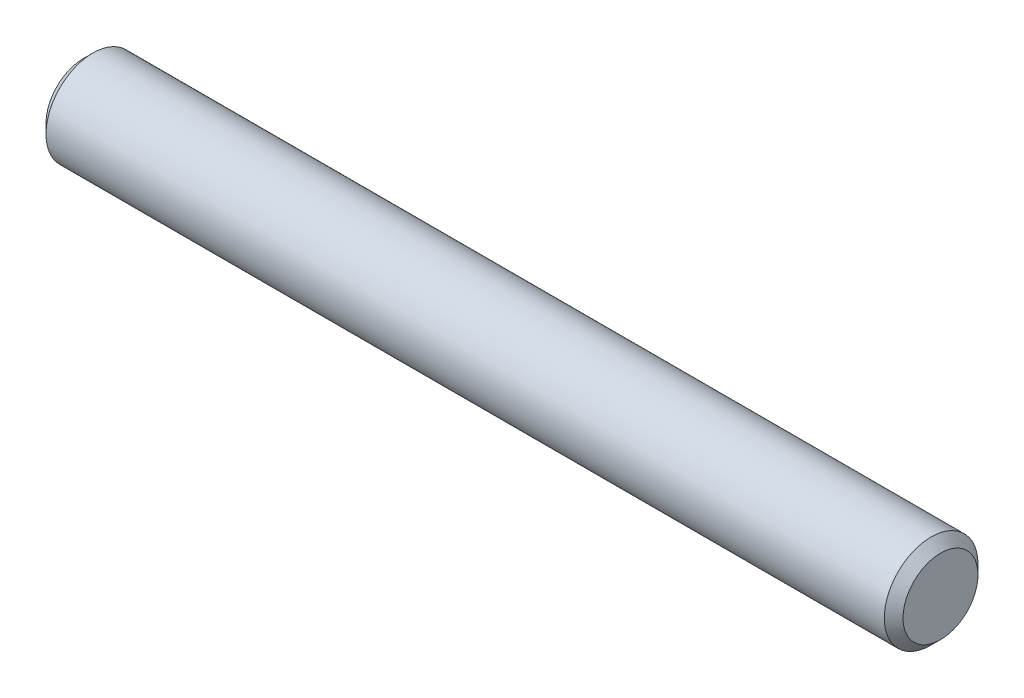
from build123d import *

# Parameters (mm, degrees)
EXTRUDE1_DEPTH      = 12.7
EXTRUDE1_DEPTH_BACK = 12.7
SKETCH2_R           = 1.3890625
CHAMFER1_SIZE       = 0.2778125


with BuildPart() as part:
    # Sketch2 → Extrude1 (new, two sides: drawn at the far end of the back side and taken through both)
    with BuildSketch(Plane(origin=(0, 0, 0), x_dir=(0, 0, -1), z_dir=(1, 0, 0)).offset(-EXTRUDE1_DEPTH_BACK)):
        Circle(SKETCH2_R)
    extrude(amount=EXTRUDE1_DEPTH + EXTRUDE1_DEPTH_BACK)

    # Chamfer1
    chamfer1_edges = [part.edges().sort_by_distance(p)[0] for p in [
        (-12.7, 0, 1.3890625),
        (12.7, 0, 1.3890625),
    ]]
    chamfer(chamfer1_edges, length=CHAMFER1_SIZE)


solid = part.part
